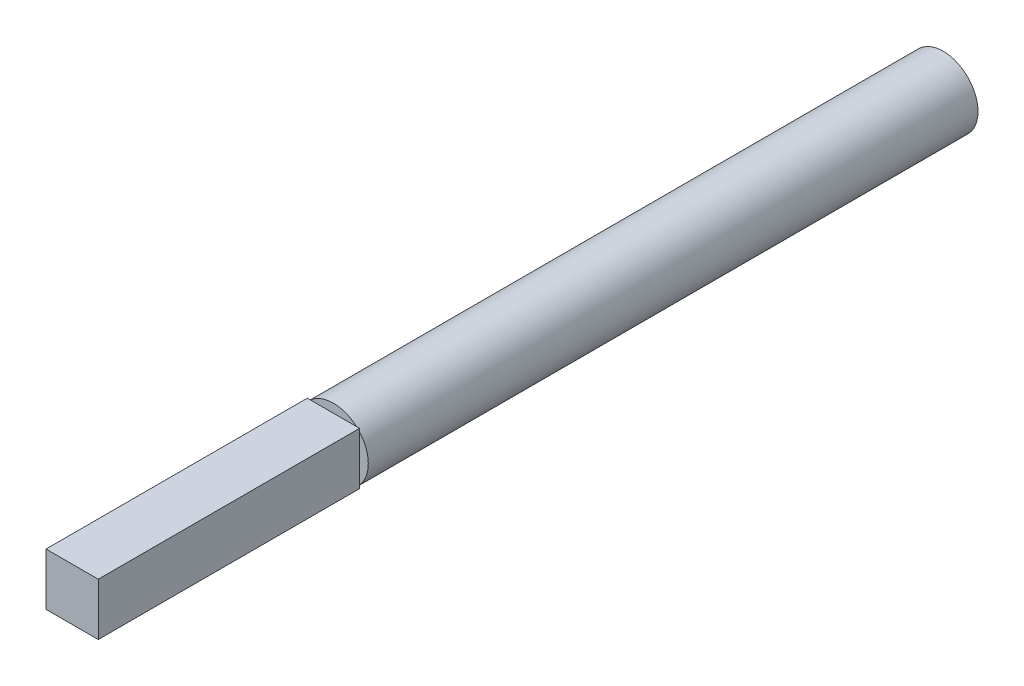
from build123d import *

# Parameters (mm, degrees)
SKETCH1_R           = 5.08
BOSS_EXTRUDE1_DEPTH = 88.9
SKETCH2_W           = 7.62
SKETCH2_H           = 7.62
BOSS_EXTRUDE2_DEPTH = 38.1


with BuildPart() as part:
    # Sketch1 → Boss-Extrude1 (new body)
    with BuildSketch(Plane.XY):
        Circle(SKETCH1_R)
    extrude(amount=BOSS_EXTRUDE1_DEPTH)

    # Sketch2 → Boss-Extrude2 (add)
    with BuildSketch(Plane.XY.offset(88.9)):
        Rectangle(SKETCH2_W, SKETCH2_H)
    extrude(amount=BOSS_EXTRUDE2_DEPTH)


solid = part.part
